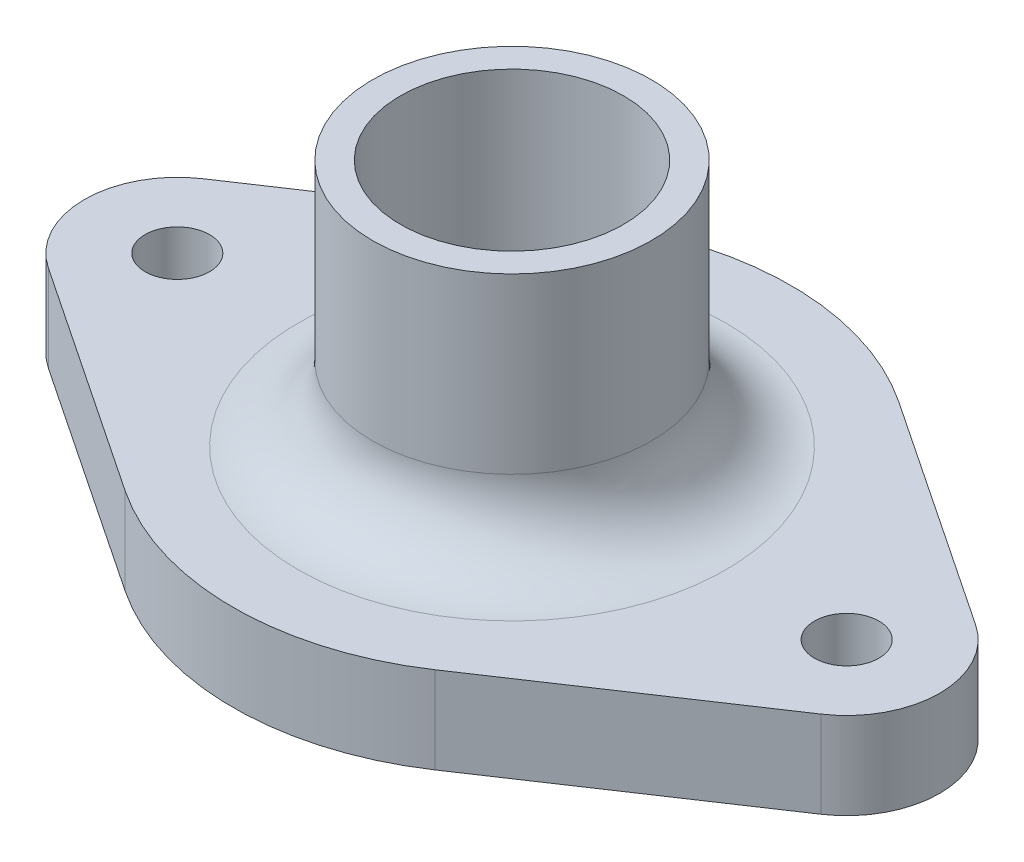
from build123d import *

# Parameters (mm, degrees)
IZIM1_R                     = 2.6
Y_KSEKLIK_EKSTR_ZYON1_DEPTH = 7
IZIM3_R                     = 11.25
IZIM3_R_2                   = 8
Y_KSEKLIK_EKSTR_ZYON2_DEPTH = 20
KES_EKSTR_ZYON1_DEPTH       = 40
KES_EKSTR_ZYON1_DEPTH_BACK  = 5
IZIM4_R                     = 9
RADYUS2_R                   = 6


with BuildPart() as part:
    # Çizim1 → Yükseklik-Ekstrüzyon1 (new body)
    with BuildSketch(Plane(origin=(0, 0, 0), x_dir=(1, 0, 0), z_dir=(0, 1, 0))):
        with BuildLine():
            Line((-31.166666667, 6.236095645), (-12.5, 18.708286934))
            ThreePointArc((-12.5, 18.708286934), (0, 22.5), (12.5, 18.708286934))
            Line((12.5, 18.708286934), (31.166666667, 6.236095645))
            ThreePointArc((31.166666667, 6.236095645), (34.5, 0), (31.166666667, -6.236095645))
            Line((31.166666667, -6.236095645), (12.5, -18.708286934))
            ThreePointArc((12.5, -18.708286934), (0, -22.5), (-12.5, -18.708286934))
            Line((-12.5, -18.708286934), (-31.166666667, -6.236095645))
            ThreePointArc((-31.166666667, -6.236095645), (-34.5, 0), (-31.166666667, 6.236095645))
        make_face()
        with Locations(Location((-27, 0, 0), (0, 0, 270))):
            Circle(IZIM1_R, mode=Mode.SUBTRACT)
        with Locations(Location((27, 0, 0), (0, 0, 270))):
            Circle(IZIM1_R, mode=Mode.SUBTRACT)
    extrude(amount=Y_KSEKLIK_EKSTR_ZYON1_DEPTH)

    # Çizim3 → Yükseklik-Ekstrüzyon2 (add)
    with BuildSketch(Plane(origin=(0, 7, 0), x_dir=(1, 0, 0), z_dir=(0, 1, 0))):
        with Locations(Location((0, 0, 0), (0, 0, 270))):
            Circle(IZIM3_R)
        with Locations(Location((0, 0, 0), (0, 0, 270))):
            Circle(IZIM3_R_2, mode=Mode.SUBTRACT)
    extrude(amount=Y_KSEKLIK_EKSTR_ZYON2_DEPTH)

    # Çizim4 → Kes-Ekstrüzyon1 (cut, two sides: drawn at the far end of the back side and taken through both)
    with BuildSketch(Plane(origin=(0, 7, 0), x_dir=(1, 0, 0), z_dir=(0, 1, 0)).offset(-KES_EKSTR_ZYON1_DEPTH_BACK)):
        with Locations(Location((0, 0, 0), (0, 0, 90))):
            Circle(IZIM4_R)
    extrude(amount=KES_EKSTR_ZYON1_DEPTH + KES_EKSTR_ZYON1_DEPTH_BACK, mode=Mode.SUBTRACT)

    # Radyus2
    radyus2_edges = [part.edges().sort_by_distance(p)[0] for p in [
        (0, 7, -11.25),
    ]]
    fillet(radyus2_edges, radius=RADYUS2_R)


solid = part.part
